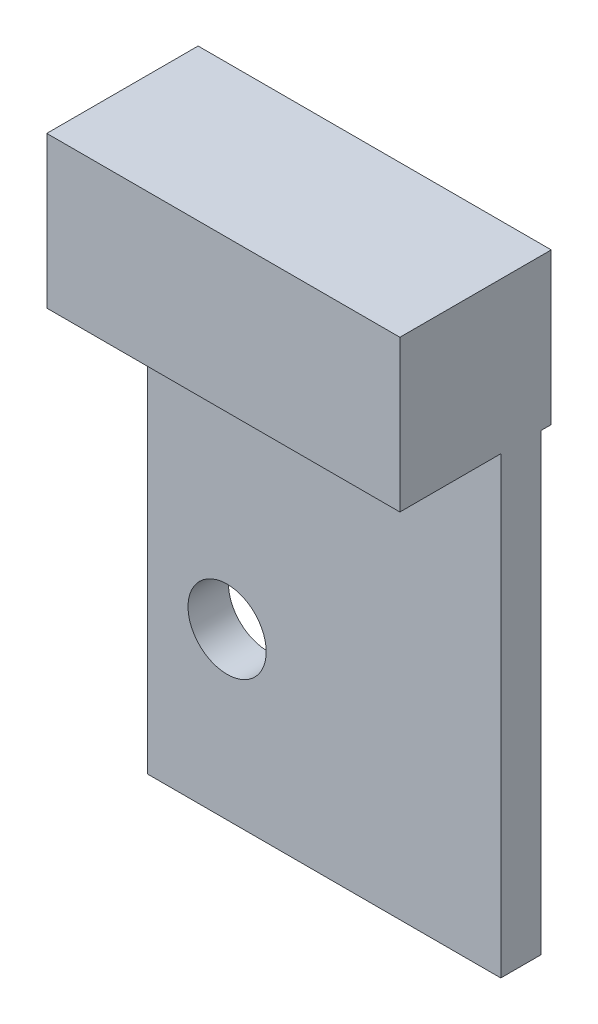
from build123d import *

# Parameters (mm, degrees)
SKETCH1_W           = 14
SKETCH1_H           = 18
BOSS_EXTRUDE1_DEPTH = 1.6
BOSS_EXTRUDE2_START = -2
SKETCH2_W           = 14
SKETCH2_H           = 6
BOSS_EXTRUDE2_DEPTH = 6
SKETCH3_R           = 1.55
CUT_EXTRUDE1_DEPTH  = 18.029386366


with BuildPart() as part:
    # Sketch1 → Boss-Extrude1 (new body)
    with BuildSketch(Plane.XY):
        Rectangle(SKETCH1_W, SKETCH1_H)
    extrude(amount=BOSS_EXTRUDE1_DEPTH)

    # Sketch2 → Boss-Extrude2 (add)
    with BuildSketch(Plane.XY.offset(1.6).offset(BOSS_EXTRUDE2_START)):
        with Locations((0, 12)):
            Rectangle(SKETCH2_W, SKETCH2_H)
    extrude(amount=BOSS_EXTRUDE2_DEPTH)

    # Sketch3 → Cut-Extrude1 (cut, through all)
    with BuildSketch(Plane.XY.offset(1.6)):
        with Locations((-3.85, -2.45)):
            Circle(SKETCH3_R)
    extrude(amount=-CUT_EXTRUDE1_DEPTH, mode=Mode.SUBTRACT)


solid = part.part
